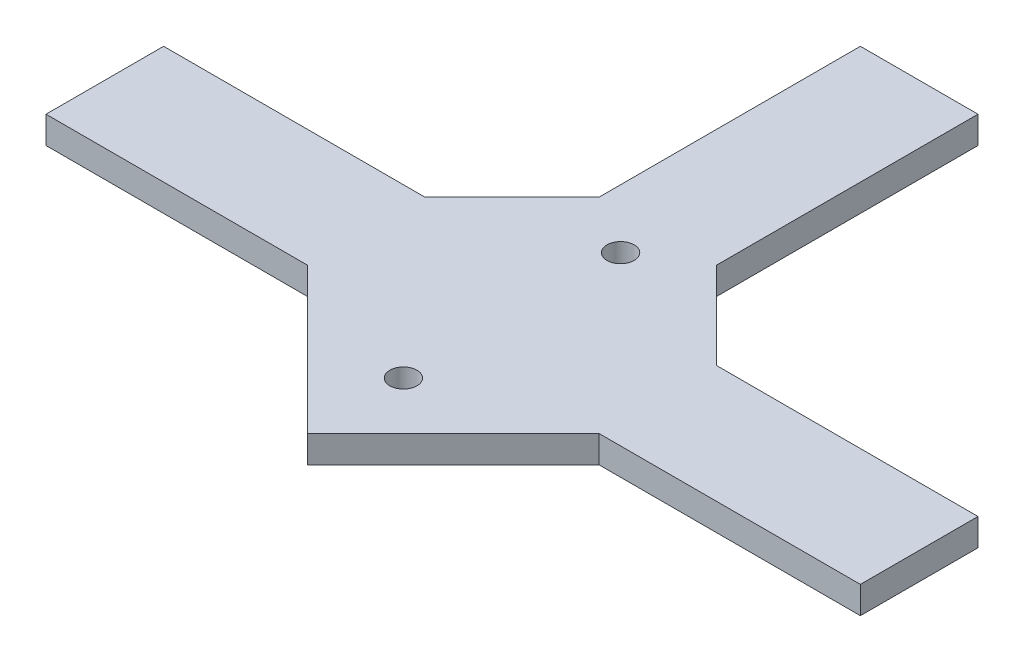
from build123d import *

# Parameters (mm, degrees)
ESBO_O1_R                = 1.5
RESSALTO_EXTRUS_O1_DEPTH = 3


with BuildPart() as part:
    # Esboço1 → Ressalto-extrusão1 (new body)
    with BuildSketch(Plane(origin=(0, 0, 0), x_dir=(1, 0, 0), z_dir=(0, 1, 0))):
        Polygon((6.5, 16.127416998), (6.5, 45), (-6.5, 45), (-6.5, 16.127416998), (-16.127416998, 6.5), (-45, 6.5), (-45, -6.5), (-16.127416998, -6.5), (0, -22.627416998), (16.127416998, -6.5), (45, -6.5), (45, 6.5), (16.127416998, 6.5), align=None)
        with Locations(Location((0, -12, 0), (0, 0, 270))):
            Circle(ESBO_O1_R, mode=Mode.SUBTRACT)
        with Locations(Location((0, 12, 0), (0, 0, 270))):
            Circle(ESBO_O1_R, mode=Mode.SUBTRACT)
    extrude(amount=RESSALTO_EXTRUS_O1_DEPTH)


solid = part.part
